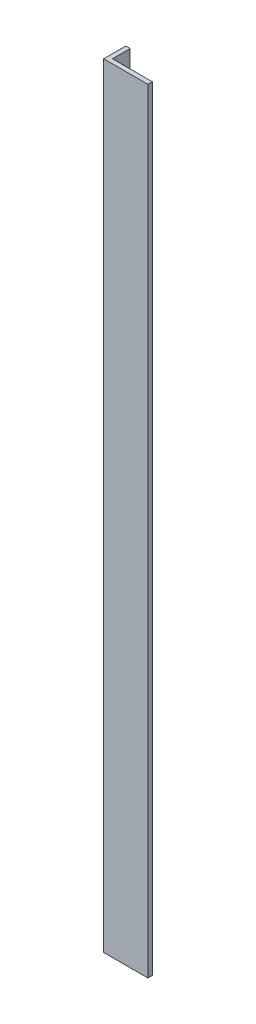
from build123d import *

# Parameters (mm, degrees)
BOSS_EXTRUDE1_DEPTH      = 350
F_3_0_3_DIAMETER_HOLE1_D = 3
F_3_0_3_DIAMETER_HOLE2_D = 3


with BuildPart() as part:
    # Sketch1 → Boss-Extrude1 (new body)
    with BuildSketch(Plane(origin=(0, 0, 0), x_dir=(1, 0, 0), z_dir=(0, 1, 0))):
        Polygon((0, 0), (0, 10), (2, 10), (2, 2), (20, 2), (20, 0), align=None)
    extrude(amount=BOSS_EXTRUDE1_DEPTH)

    # Ø3.0 (3) Diameter Hole1 (through all)
    with Locations(Plane(origin=(2, 361.407632793, -188.67995168), x_dir=(0, 0, 1), z_dir=(1, 0, 0))):
        with Locations((182.67995168, 355.407632793), (182.67995168, 341.407632793)):
            Hole(F_3_0_3_DIAMETER_HOLE1_D / 2)

    # Ø3.0 (3) Diameter Hole2 (through all)
    with Locations(Plane(origin=(2, 361.407632793, -188.67995168), x_dir=(0, 0, 1), z_dir=(1, 0, 0))):
        with Locations((182.67995168, 17.407632793), (182.67995168, 31.407632793)):
            Hole(F_3_0_3_DIAMETER_HOLE2_D / 2)


solid = part.part
